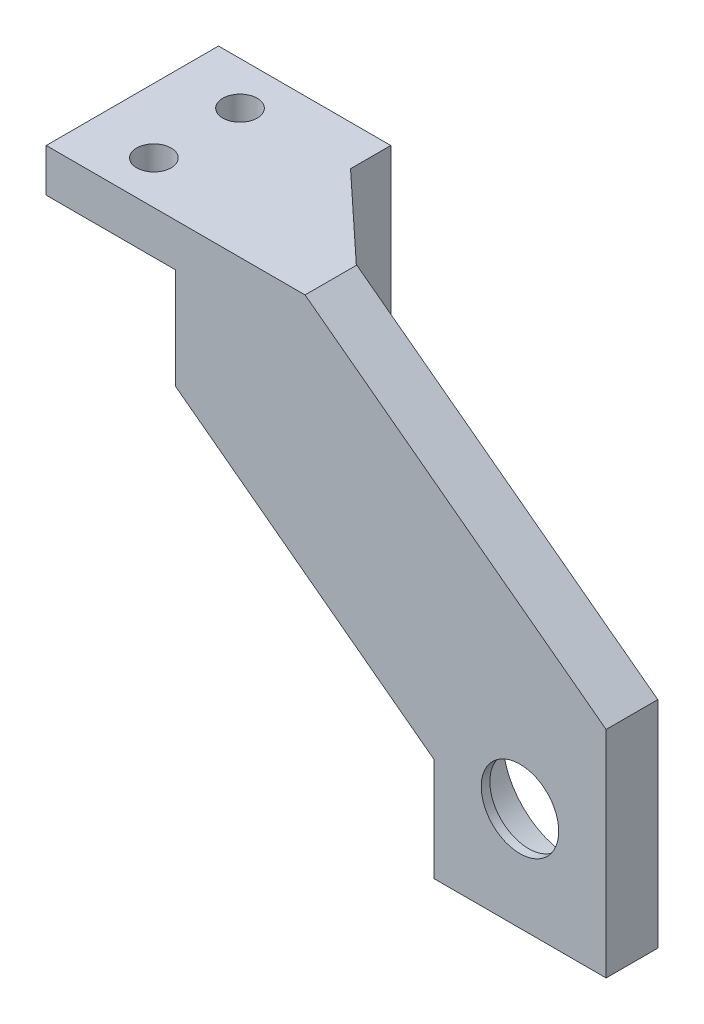
from build123d import *

# Parameters (mm, degrees)
SKETCH1_R               = 10
SKETCH1_R_2             = 8
SKETCH1_R_3             = 4.5
BOSS_EXTRUDE1_DEPTH     = 1
BOSS_EXTRUDE2_START     = -5
SKETCH1_4_R             = 10
SKETCH1_4_R_2           = 8
BOSS_EXTRUDE2_DEPTH     = 5
BOSS_EXTRUDE3_START     = -6
BOSS_EXTRUDE3_DEPTH     = 6
BOSS_EXTRUDE4_DEPTH     = 5
BOSS_EXTRUDE5_REACH     = 76.3
SKETCH4_R               = 2
CUT_EXTRUDE1_DEPTH      = 78.507677039
CUT_EXTRUDE2_DEPTH      = 71.438909702
CUT_EXTRUDE2_DEPTH_BACK = 71.438909702


with BuildPart() as part:
    # Sketch1 → Boss-Extrude1 (new body)
    # profile 1 of 2: a face of its own
    with BuildSketch(Plane.XY):
        Circle(SKETCH1_R)
        Circle(SKETCH1_R_2, mode=Mode.SUBTRACT)
    # profile 2 of 2: a face of its own
    with BuildSketch(Plane.XY):
        Circle(SKETCH1_R_2)
        Circle(SKETCH1_R_3, mode=Mode.SUBTRACT)
    extrude(amount=BOSS_EXTRUDE1_DEPTH)

    # Sketch1<4> → Boss-Extrude2 (add)
    with BuildSketch(Plane.XY.offset(BOSS_EXTRUDE2_START)):
        Circle(SKETCH1_4_R)
        Circle(SKETCH1_4_R_2, mode=Mode.SUBTRACT)
    extrude(amount=BOSS_EXTRUDE2_DEPTH)

    # Sketch2 → Boss-Extrude3 (add)
    with BuildSketch(Plane.XY.offset(1).offset(BOSS_EXTRUDE3_START)):
        with BuildLine():
            Line((-40, 34.2), (-40, 22.5))
            Line((-40, 22.5), (-10, 0))
            ThreePointArc((-10, 0), (0, 10), (10, 0))
            Line((10, 0), (10, 34.2))
            Line((10, 34.2), (-40, 34.2))
        make_face()
        with BuildLine():
            ThreePointArc((10, 0), (0, -10), (-10, 0))
            Line((-10, 0), (-10, -12))
            Line((-10, -12), (10, -12))
            Line((10, -12), (10, 0))
        make_face()
    extrude(amount=BOSS_EXTRUDE3_DEPTH)

    # Sketch3 → Boss-Extrude4 (add)
    with BuildSketch(Plane(origin=(0, 34.2, 0), x_dir=(1, 0, 0), z_dir=(0, 1, 0))):
        Polygon((-55, -1), (-40, -1), (-40, 5), (-40, 19), (-55, 19), align=None)
        Polygon((-40, 19), (-40, 5), (-35, 5), (-35, 14.33), (-35, 19), align=None)
        Polygon((-35, 14.33), (-35, 5), (-25, 5), align=None)
        Polygon((-40, 5), (-40, -1), (10, -1), (10, 5), (-25, 5), (-35, 5), align=None)
    extrude(amount=BOSS_EXTRUDE4_DEPTH)

    # Boss-Extrude5: up to this plane
    boss_extrude5_end = Plane(origin=(-3.6, -4.8, -65.577553599), z_dir=(-0.6000000000000177, -0.7999999999999867, 0))
    # Sketch3<4> → Boss-Extrude5 (add, up to the surface)
    with BuildSketch(Plane(origin=(0, 34.2, 0), x_dir=(1, 0, 0), z_dir=(0, 1, 0)), mode=Mode.PRIVATE) as boss_extrude5_sk1:
        Polygon((-40, 19), (-40, 5), (-35, 5), (-35, 14.33), (-35, 19), align=None)
    boss_extrude5_tool1 = split(extrude(boss_extrude5_sk1.sketch, amount=-BOSS_EXTRUDE5_REACH, mode=Mode.PRIVATE), bisect_by=boss_extrude5_end, keep=Keep.BOTH, mode=Mode.PRIVATE)
    add(boss_extrude5_tool1.solids().sort_by_distance((-37.5, 34.2, -12))[0])
    # Sketch3<4> → Boss-Extrude5 (add, up to the surface)
    with BuildSketch(Plane(origin=(0, 34.2, 0), x_dir=(1, 0, 0), z_dir=(0, 1, 0)), mode=Mode.PRIVATE) as boss_extrude5_sk2:
        Polygon((-35, 14.33), (-35, 5), (-25, 5), align=None)
    boss_extrude5_tool2 = split(extrude(boss_extrude5_sk2.sketch, amount=-BOSS_EXTRUDE5_REACH, mode=Mode.PRIVATE), bisect_by=boss_extrude5_end, keep=Keep.BOTH, mode=Mode.PRIVATE)
    add(boss_extrude5_tool2.solids().sort_by_distance((-31.666667, 34.2, -8.11))[0])

    # Sketch4 → Cut-Extrude1 (cut, through all)
    with BuildSketch(Plane(origin=(0, 39.2, 0), x_dir=(1, 0, 0), z_dir=(0, 1, 0))):
        with Locations(Location((-47.5, 14, 0), (0, 0, 270))):
            Circle(SKETCH4_R)
        with Locations(Location((-47.5, 4, 0), (0, 0, 270))):
            Circle(SKETCH4_R)
    extrude(amount=-CUT_EXTRUDE1_DEPTH, mode=Mode.SUBTRACT)

    # Sketch5 → Cut-Extrude2 (cut, two sides: drawn at the far end of the back side and taken through both)
    with BuildSketch(Plane.XY.offset(1).offset(-CUT_EXTRUDE2_DEPTH_BACK)):
        Polygon((0, 20.48842356), (-24.948768587, 39.2), (10, 39.2), (10, 12.98842356), align=None)
    extrude(amount=CUT_EXTRUDE2_DEPTH + CUT_EXTRUDE2_DEPTH_BACK, mode=Mode.SUBTRACT)


solid = part.part
